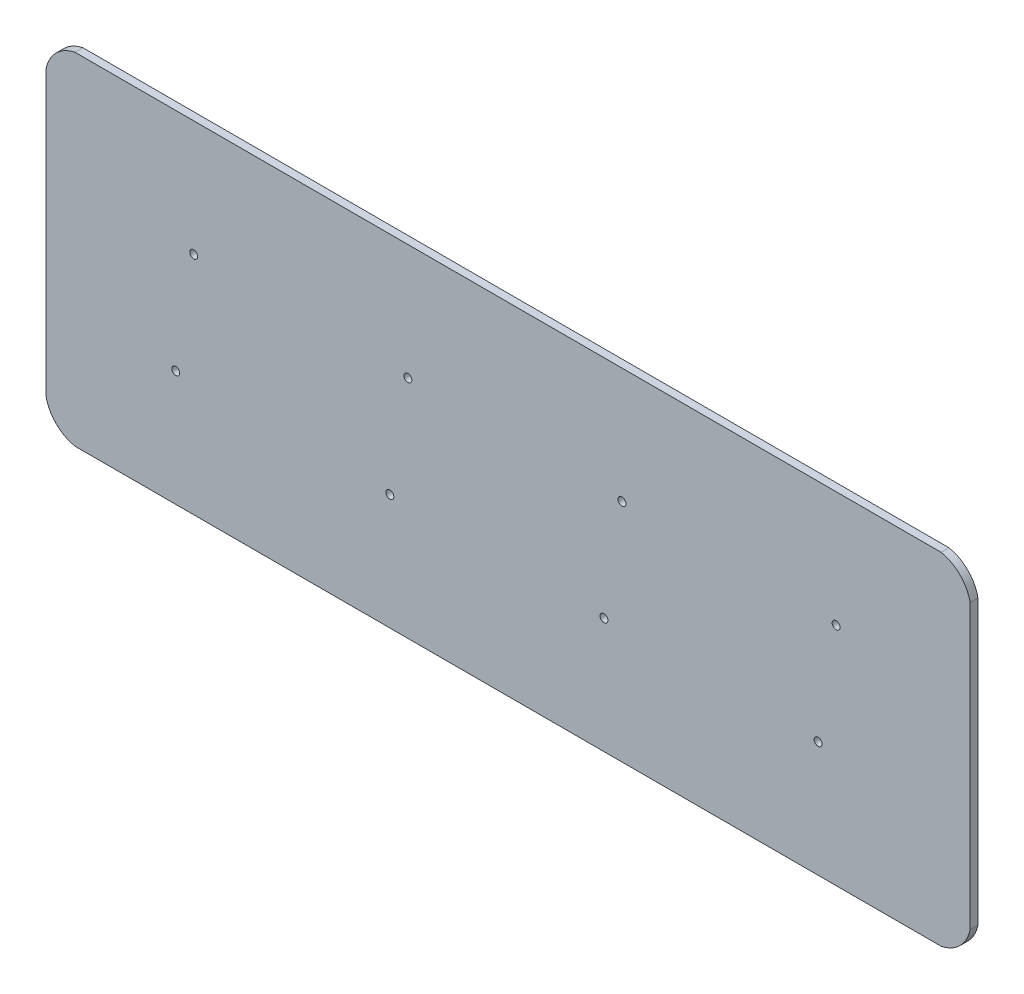
from build123d import *

# Parameters (mm, degrees)
MODEL_R                 = 1.5
SALIENTE_EXTRUIR1_DEPTH = 3


with BuildPart() as part:
    # Model → Saliente-Extruir1 (new body)
    with BuildSketch(Plane.XY):
        with BuildLine():
            Line((169.825482687, 67.503139244), (-160.174517313, 67.503139244))
            ThreePointArc((-160.174517313, 67.503139244), (-167.39341138, 63.661659725), (-171.234890898, 56.442765658))
            Line((-171.234890898, 56.442765658), (-171.234890898, -51.436487171))
            ThreePointArc((-171.234890898, -51.436487171), (-167.39341138, -58.655381238), (-160.174517313, -62.496860756))
            Line((-160.174517313, -62.496860756), (169.825482687, -62.496860756))
            ThreePointArc((169.825482687, -62.496860756), (177.044376754, -58.655381238), (180.885856273, -51.436487171))
            Line((180.885856273, -51.436487171), (180.885856273, 56.442765658))
            ThreePointArc((180.885856273, 56.442765658), (177.044376754, 63.661659725), (169.825482687, 67.503139244))
        make_face()
        with Locations((-114.944890898, 23.453139244)):
            Circle(MODEL_R, mode=Mode.SUBTRACT)
        with Locations((-121.804890898, -18.456860756)):
            Circle(MODEL_R, mode=Mode.SUBTRACT)
        with Locations((-33.354890898, 23.453139244)):
            Circle(MODEL_R, mode=Mode.SUBTRACT)
        with Locations((-40.214890898, -18.456860756)):
            Circle(MODEL_R, mode=Mode.SUBTRACT)
        with Locations((48.235109102, 23.453139244)):
            Circle(MODEL_R, mode=Mode.SUBTRACT)
        with Locations((41.375109102, -18.456860756)):
            Circle(MODEL_R, mode=Mode.SUBTRACT)
        with Locations((129.825109102, 23.453139244)):
            Circle(MODEL_R, mode=Mode.SUBTRACT)
        with Locations((122.965109102, -18.456860756)):
            Circle(MODEL_R, mode=Mode.SUBTRACT)
    extrude(amount=SALIENTE_EXTRUIR1_DEPTH)


solid = part.part
